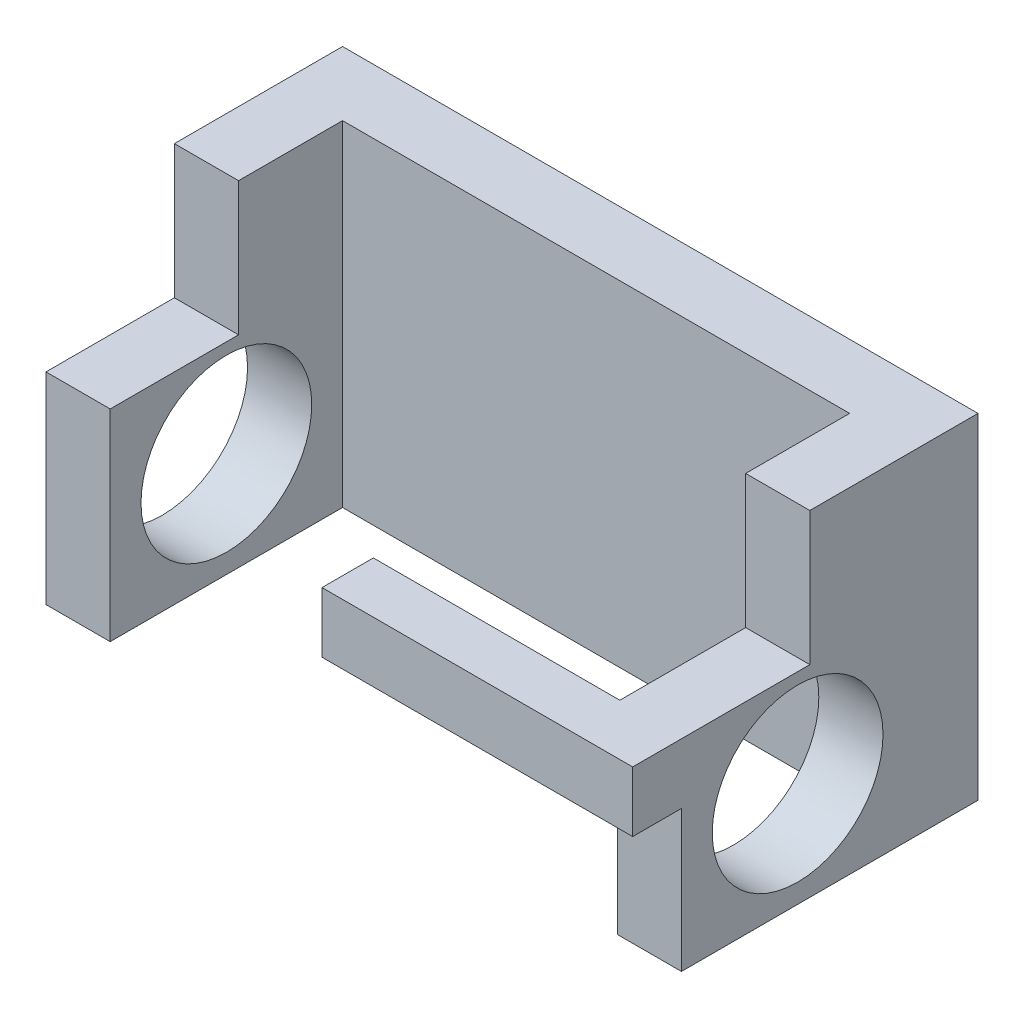
from build123d import *

# Parameters (mm, degrees)
CROQUIS2_W              = 49.5
CROQUIS2_H              = 26.9
SALIENTE_EXTRUIR1_DEPTH = 26.1
CORTAR_EXTRUIR2_DEPTH   = 26.1
CORTAR_EXTRUIR3_REACH   = 64.089
CROQUIS3_W              = 13.8
CROQUIS3_H              = 10.4
CORTAR_EXTRUIR4_REACH   = 60.181
CROQUIS9_R              = 6.65
CORTAR_EXTRUIR5_REACH   = 64.089
CROQUIS8_R              = 6.65
CORTAR_EXTRUIR6_DEPTH   = 10.4
CROQUIS10_W             = 24.2
CROQUIS10_H             = 11
CORTAR_EXTRUIR7_DEPTH   = 3.8
CROQUIS13_W             = 19.2
CROQUIS13_H             = 11
CORTAR_EXTRUIR8_DEPTH   = 0.2
CORTAR_EXTRUIR9_REACH   = 64.089
CROQUIS14_W             = 3.8
CROQUIS14_H             = 15.7
CROQUIS16_W             = 4
CROQUIS16_H             = 4.7
SALIENTE_EXTRUIR2_DEPTH = 19.2
CROQUIS17_W             = 3.8
CROQUIS17_H             = 4.7
SALIENTE_EXTRUIR3_DEPTH = 5
CORTAR_EXTRUIR10_REACH  = 60.326


with BuildPart() as part:
    # Croquis2 → Saliente-Extruir1 (new body)
    with BuildSketch(Plane(origin=(0, 0, 0), x_dir=(1, 0, 0), z_dir=(0, 1, 0))):
        with Locations((-24.75, -13.45)):
            Rectangle(CROQUIS2_W, CROQUIS2_H)
    extrude(amount=SALIENTE_EXTRUIR1_DEPTH)

    # Croquis6 → Cortar-Extruir2 (cut)
    with BuildSketch(Plane(origin=(0, 26.1, 0), x_dir=(1, 0, 0), z_dir=(0, 1, 0))):
        Polygon((-44.5, -21.9), (-44.5, -22.9), (-25.3, -22.9), (-25.3, -26.9), (-5, -26.9), (-5, -21.9), (-5, -5), (-44.5, -5), align=None)
    extrude(amount=-CORTAR_EXTRUIR2_DEPTH, mode=Mode.SUBTRACT)

    # Croquis3 → Cortar-Extruir3 (cut, up to next)
    with BuildSketch(Plane(origin=(0, 0, 0), x_dir=(0, 0, -1), z_dir=(1, 0, 0)), mode=Mode.PRIVATE) as cortar_extruir3_sk1:
        with Locations((-20, 20.9)):
            Rectangle(CROQUIS3_W, CROQUIS3_H)
    cortar_extruir3_tool1 = extrude(cortar_extruir3_sk1.sketch, amount=-CORTAR_EXTRUIR3_REACH, mode=Mode.PRIVATE) & part.part
    add(cortar_extruir3_tool1.solids().sort_by_distance((0, 20.9, 20))[0], mode=Mode.SUBTRACT)

    # Croquis9 → Cortar-Extruir4 (cut, up to next)
    with BuildSketch(Plane(origin=(-44.5, 0, 0), x_dir=(0, 0, -1), z_dir=(1, 0, 0)), mode=Mode.PRIVATE) as cortar_extruir4_sk1:
        with Locations((-14.05, 8.15)):
            Circle(CROQUIS9_R)
    cortar_extruir4_tool1 = extrude(cortar_extruir4_sk1.sketch, amount=-CORTAR_EXTRUIR4_REACH, mode=Mode.PRIVATE) & part.part
    add(cortar_extruir4_tool1.solids().sort_by_distance((-44.5, 8.15, 14.05))[0], mode=Mode.SUBTRACT)

    # Croquis8 → Cortar-Extruir5 (cut, up to next)
    with BuildSketch(Plane(origin=(0, 0, 0), x_dir=(0, 0, -1), z_dir=(1, 0, 0)), mode=Mode.PRIVATE) as cortar_extruir5_sk1:
        with Locations((-14.05, 8.15)):
            Circle(CROQUIS8_R)
    cortar_extruir5_tool1 = extrude(cortar_extruir5_sk1.sketch, amount=-CORTAR_EXTRUIR5_REACH, mode=Mode.PRIVATE) & part.part
    add(cortar_extruir5_tool1.solids().sort_by_distance((0, 8.15, 14.05))[0], mode=Mode.SUBTRACT)

    # Croquis11 → Cortar-Extruir6 (cut)
    with BuildSketch(Plane(origin=(0, 26.1, 0), x_dir=(1, 0, 0), z_dir=(0, 1, 0))):
        Polygon((-44.5, -13.1), (-49.5, -13.1), (-49.5, -26.9), (-25.3, -26.9), (-25.3, -22.9), (-44.5, -22.9), align=None)
    extrude(amount=-CORTAR_EXTRUIR6_DEPTH, mode=Mode.SUBTRACT)

    # Croquis10 → Cortar-Extruir7 (cut)
    with BuildSketch(Plane.XY.offset(26.9)):
        with Locations((-37.4, 5.5)):
            Rectangle(CROQUIS10_W, CROQUIS10_H)
    extrude(amount=-CORTAR_EXTRUIR7_DEPTH, mode=Mode.SUBTRACT)

    # Croquis13 → Cortar-Extruir8 (cut)
    with BuildSketch(Plane(origin=(0, 0, 22.9), x_dir=(-1, 0, 0), z_dir=(0, 0, -1))):
        with Locations((34.9, 5.5)):
            Rectangle(CROQUIS13_W, CROQUIS13_H)
    extrude(amount=-CORTAR_EXTRUIR8_DEPTH, mode=Mode.SUBTRACT)

    # Croquis14 → Cortar-Extruir9 (cut, up to next)
    with BuildSketch(Plane(origin=(0, 0, 0), x_dir=(0, 0, -1), z_dir=(1, 0, 0)), mode=Mode.PRIVATE) as cortar_extruir9_sk1:
        with Locations((-25, 7.85)):
            Rectangle(CROQUIS14_W, CROQUIS14_H)
    cortar_extruir9_tool1 = extrude(cortar_extruir9_sk1.sketch, amount=-CORTAR_EXTRUIR9_REACH, mode=Mode.PRIVATE) & part.part
    add(cortar_extruir9_tool1.solids().sort_by_distance((0, 7.85, 25))[0], mode=Mode.SUBTRACT)

    # Croquis16 → Saliente-Extruir2 (add)
    with BuildSketch(Plane.ZY.offset(5)):
        with Locations((24.9, 13.35)):
            Rectangle(CROQUIS16_W, CROQUIS16_H)
    extrude(amount=SALIENTE_EXTRUIR2_DEPTH)

    # Croquis17 → Saliente-Extruir3 (add)
    with BuildSketch(Plane(origin=(-5, 0, 0), x_dir=(0, 0, -1), z_dir=(1, 0, 0))):
        with Locations((-25, 13.35)):
            Rectangle(CROQUIS17_W, CROQUIS17_H)
    extrude(amount=SALIENTE_EXTRUIR3_DEPTH)

    # Croquis18 → Cortar-Extruir10 (cut, up to next)
    with BuildSketch(Plane.XZ.offset(-11), mode=Mode.PRIVATE) as cortar_extruir10_sk1:
        Polygon((-25.3, 26.9), (-49.5, 26.9), (-49.5, 23.1), (-44.5, 23.1), (-44.5, 22.9), (-25.3, 22.9), align=None)
    cortar_extruir10_tool1 = extrude(cortar_extruir10_sk1.sketch, amount=-CORTAR_EXTRUIR10_REACH, mode=Mode.PRIVATE) & part.part
    add(cortar_extruir10_tool1.solids().sort_by_distance((-37.299791, 11, 24.919833))[0], mode=Mode.SUBTRACT)


solid = part.part
